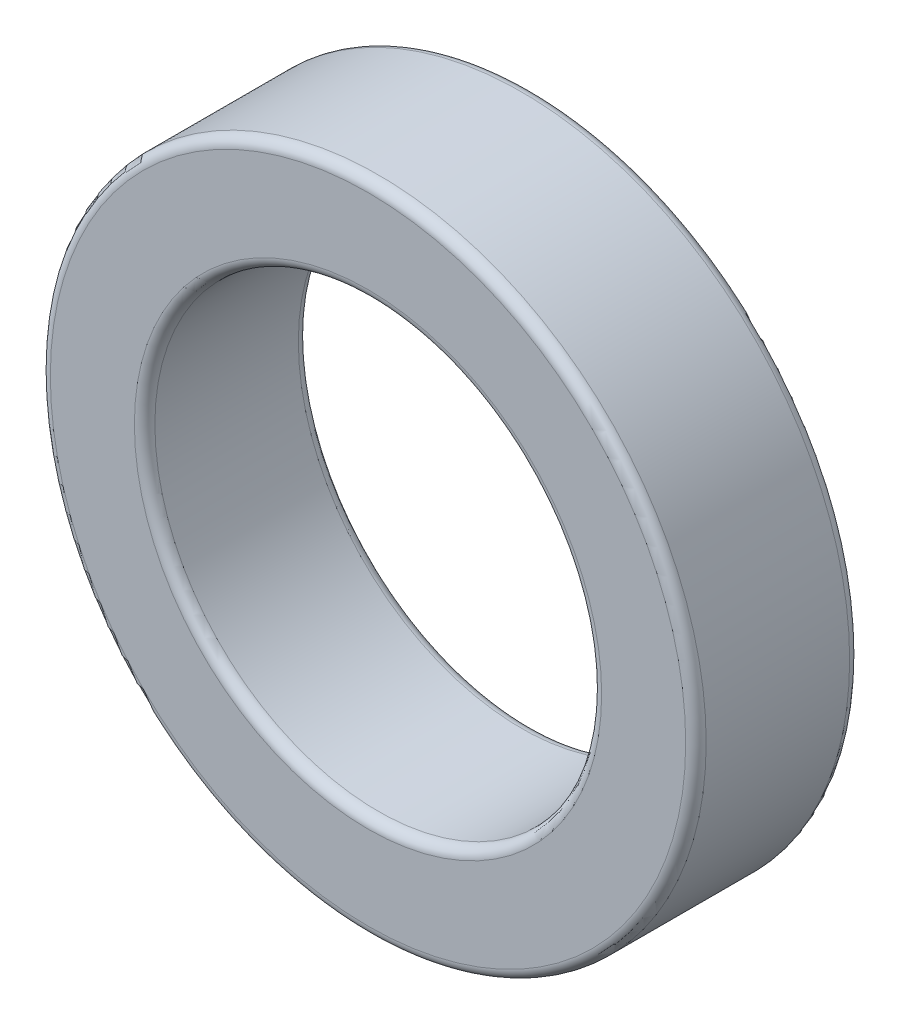
from build123d import *

# Parameters (mm, degrees)
SKETCH1_R           = 16
SKETCH1_R_2         = 10.9
BOSS_EXTRUDE1_DEPTH = 8
FILLET1_R           = 0.5


with BuildPart() as part:
    # Sketch1 → Boss-Extrude1 (new body)
    with BuildSketch(Plane.XY):
        Circle(SKETCH1_R)
        Circle(SKETCH1_R_2, mode=Mode.SUBTRACT)
    extrude(amount=BOSS_EXTRUDE1_DEPTH)

    # Fillet1
    fillet1_edges = [part.edges().sort_by_distance(p)[0] for p in [
        (-16, 0, 0),
        (-16, 0, 8),
        (-10.9, 0, 0),
        (-10.9, 0, 8),
    ]]
    fillet(fillet1_edges, radius=FILLET1_R)


solid = part.part
